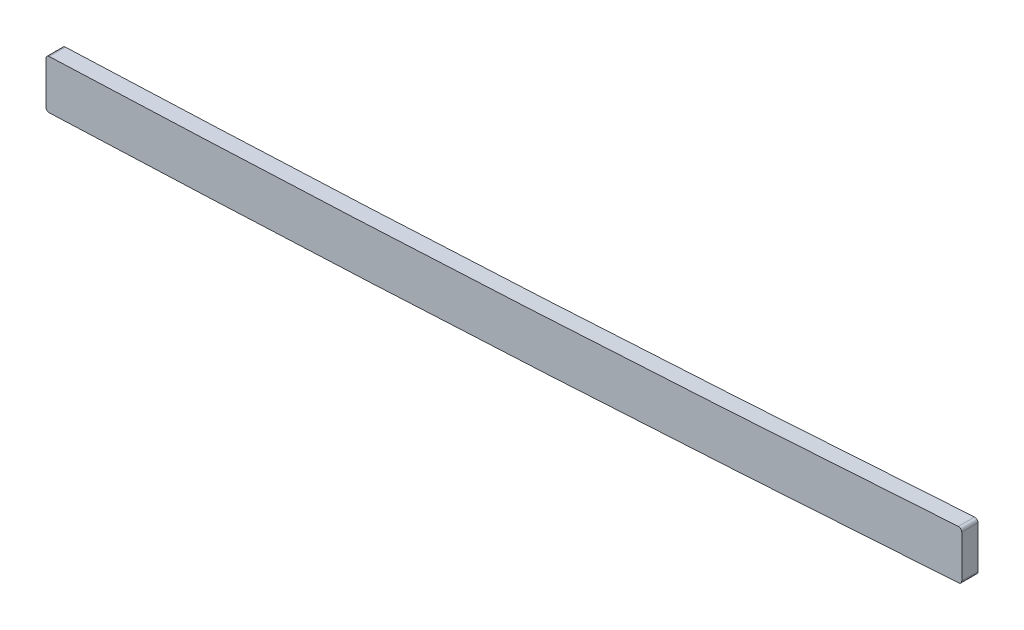
from build123d import *

# Parameters (mm, degrees)
BOSS_EXTRUDE1_DEPTH = 3.175
FILLET1_R           = 1.27


with BuildPart() as part:
    # Sketch1 → Boss-Extrude1 (new, symmetric)
    with BuildSketch(Plane.XY):
        with BuildLine():
            Line((2311.4, -9.245652974), (2311.4, -28.310356345))
            add(Edge.make_bspline(
                [(2669.54, -9.569049356), (2615.393603553, -13.17073937), (2561.080658619, -16.536108081), (2506.205230446, -19.758621957), (2434.382223772, -23.29947809), (2362.559217098, -26.286274493), (2345.393069943, -26.972929947), (2328.342945407, -27.644579597), (2311.4, -28.310356345)],
                knots=[103.698913506, 103.698913506, 103.698913506, 103.698913506, 103.698913506, 103.698913506, 130.927896619, 130.927896619, 130.927896619, 139.270260279, 139.270260279, 139.270260279, 139.270260279, 139.270260279, 139.270260279], degree=5))
            Line((2669.54, -9.569049356), (2669.54, 9.5231025))
            add(Edge.make_bspline(
                [(2669.54, 9.5231025), (2667.126494524, 9.36235515), (2659.861586685, 8.880281494), (2635.666282302, 7.292469146), (2596.857665529, 4.826056853), (2545.729743039, 1.758344093), (2494.405305707, -1.098555235), (2451.533022267, -3.266573297), (2417.198316756, -4.86708361), (2391.457076919, -6.003589235), (2365.634736307, -7.086854581), (2341.015642019, -8.078542398), (2322.924133841, -8.79260451), (2313.562932275, -9.160652062), (2311.4, -9.245652974)],
                knots=[103.571582669, 103.571582669, 103.571582669, 103.571582669, 104.300777207, 105.766098403, 110.877392287, 115.98868617, 121.099980054, 126.211273938, 128.76692088, 131.322567822, 133.878214764, 136.433861706, 138.557690156, 139.196601892, 139.196601892, 139.196601892, 139.196601892], degree=3))
        make_face()
    extrude(amount=BOSS_EXTRUDE1_DEPTH, both=True)

    # Fillet1
    fillet1_edges = [part.edges().sort_by_distance(p)[0] for p in [
        (2669.54, 9.5231025, -1.5875),
        (2669.54, -9.569049356, -1.5875),
        (2311.4, -9.245652974, -1.5875),
        (2311.4, -28.310356345, -1.5875),
    ]]
    fillet(fillet1_edges, radius=FILLET1_R)


solid = part.part
